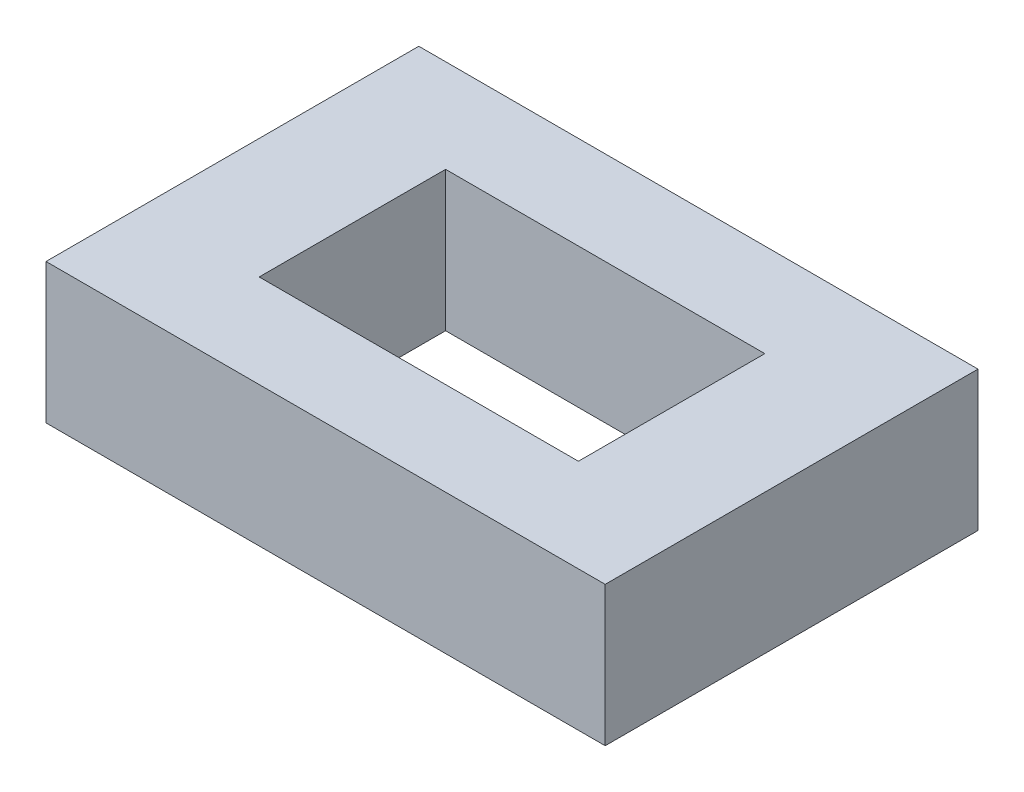
from build123d import *

# Parameters (mm, degrees)
SKETCH1_W           = 12
SKETCH1_H           = 8
BOSS_EXTRUDE1_DEPTH = 3
SKETCH2_W           = 6.85
SKETCH2_H           = 4
CUT_EXTRUDE1_DEPTH  = 3


with BuildPart() as part:
    # Sketch1 → Boss-Extrude1 (new body)
    with BuildSketch(Plane(origin=(0, 0, 0), x_dir=(1, 0, 0), z_dir=(0, 1, 0))):
        Rectangle(SKETCH1_W, SKETCH1_H)
    extrude(amount=BOSS_EXTRUDE1_DEPTH)

    # Sketch2 → Cut-Extrude1 (cut)
    with BuildSketch(Plane(origin=(0, 3, 0), x_dir=(1, 0, 0), z_dir=(0, 1, 0))):
        Rectangle(SKETCH2_W, SKETCH2_H)
    extrude(amount=-CUT_EXTRUDE1_DEPTH, mode=Mode.SUBTRACT)


solid = part.part
